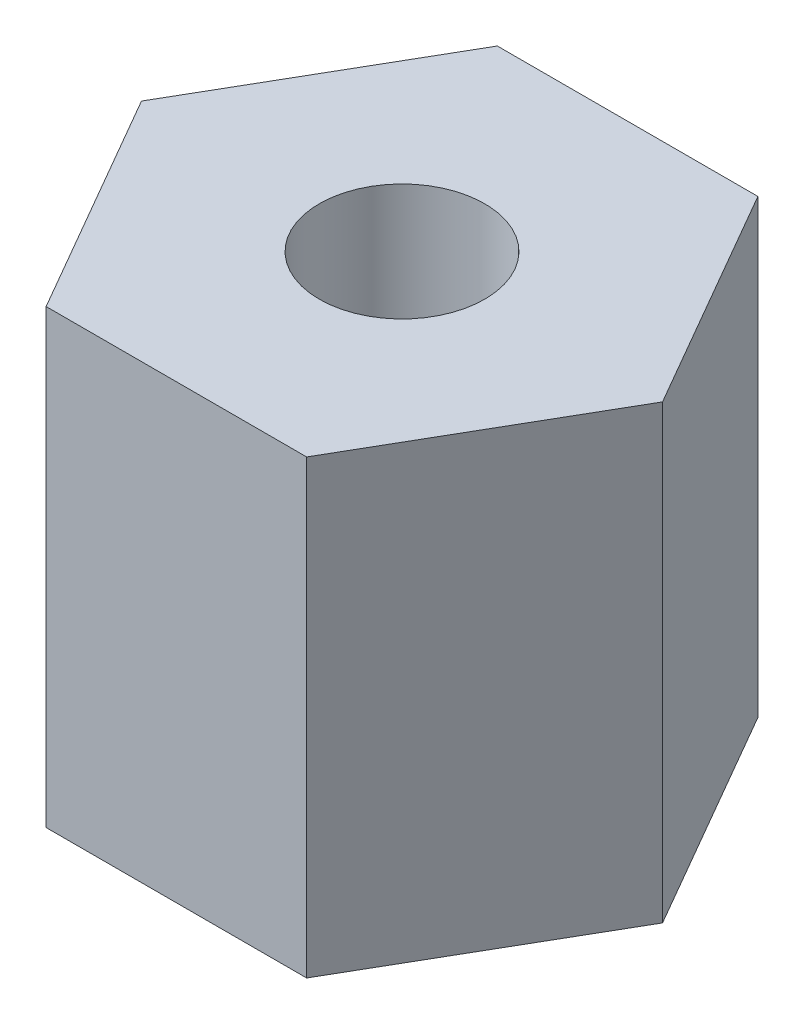
from build123d import *

# Parameters (mm, degrees)
SKETCH1_R           = 1.1
BOSS_EXTRUDE1_DEPTH = 6


with BuildPart() as part:
    # Sketch1 → Boss-Extrude1 (new body)
    with BuildSketch(Plane(origin=(0, 0, 0), x_dir=(1, 0, 0), z_dir=(0, 1, 0))):
        Polygon((3.464101615, 0), (1.732050808, 3), (-1.732050808, 3), (-3.464101615, 0), (-1.732050808, -3), (1.732050808, -3), align=None)
        with Locations(Location((0, 0, 0), (0, 0, 270))):
            Circle(SKETCH1_R, mode=Mode.SUBTRACT)
    extrude(amount=BOSS_EXTRUDE1_DEPTH)


solid = part.part
